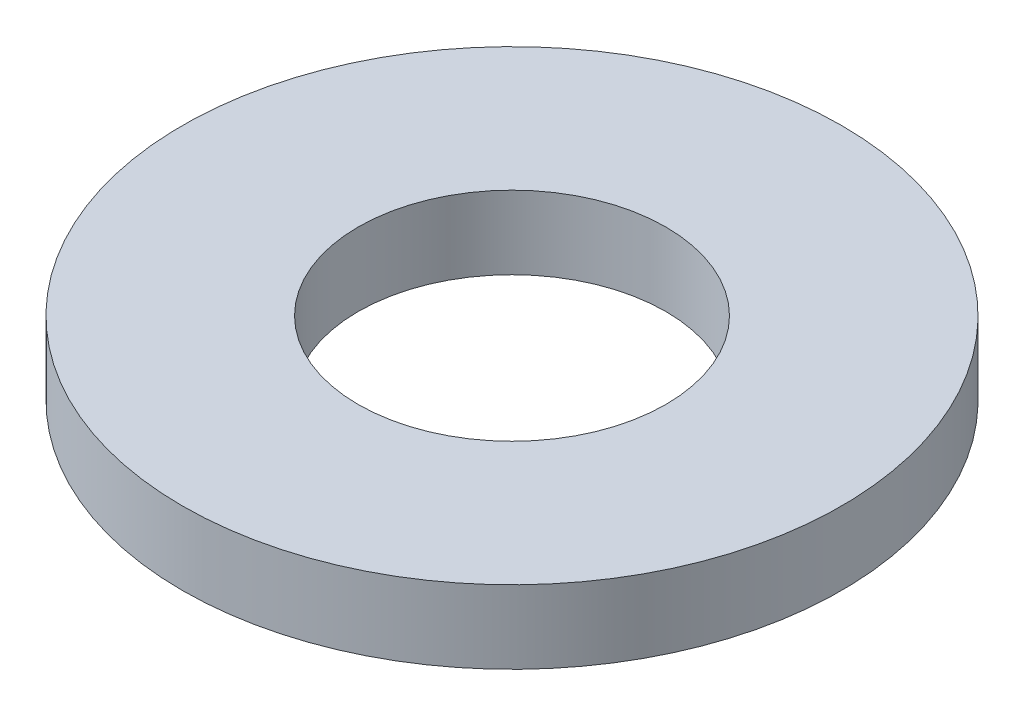
from build123d import *

# Parameters (mm, degrees)
SKETCH_1_W = 2.4
SKETCH_1_H = 1


with BuildPart() as part:
    # Эскиз1 → Повернуть1 (revolve)
    with BuildSketch(Plane.XY, mode=Mode.PRIVATE) as revolve_1_sk:
        with Locations((3.3, 0.5)):
            Rectangle(SKETCH_1_W, SKETCH_1_H)
    revolve(revolve_1_sk.sketch.rotate(Axis((0, 0, 0), (0, 1, 0)), 90), axis=Axis((0, 0, 0), (0, 1, 0)))


solid = part.part
